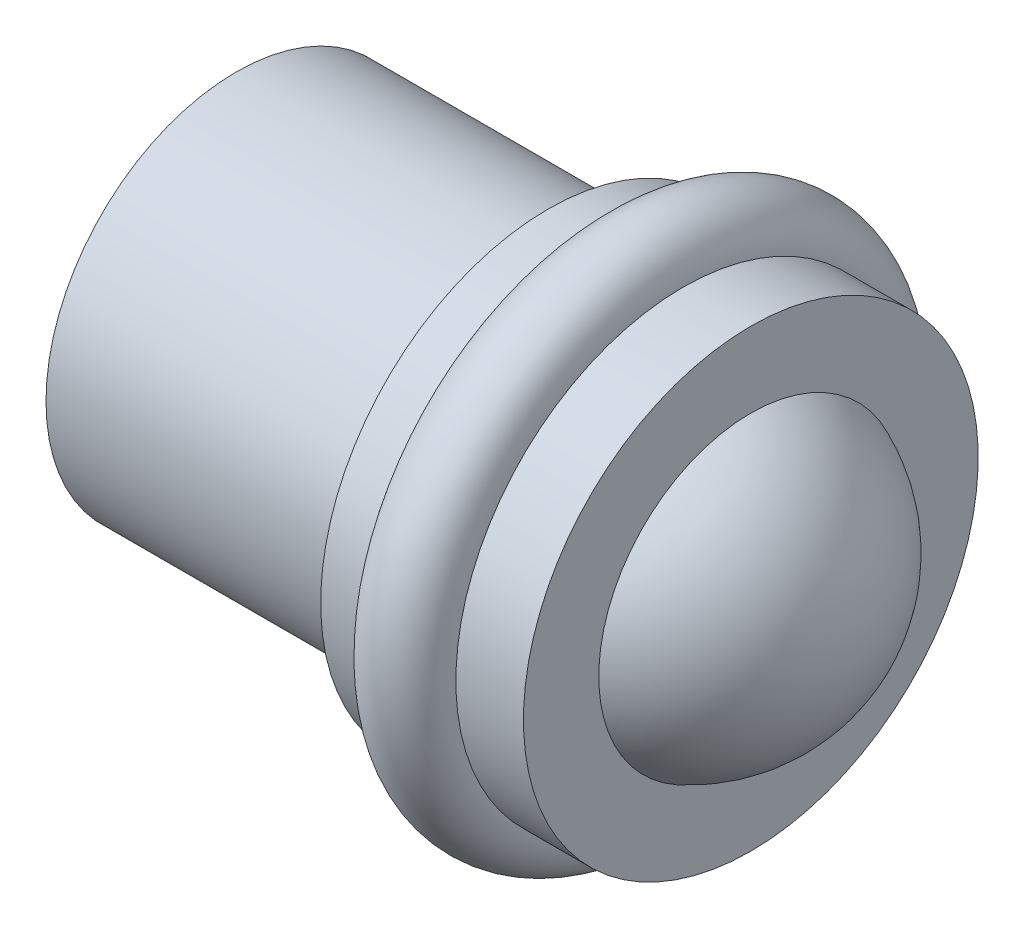
from build123d import *

# Parameters (mm, degrees)
SKETCH2_R = 1.11125


with BuildPart() as part:
    # Sketch1 → Revolve1 (revolve)
    with BuildSketch(Plane.XY, mode=Mode.PRIVATE) as revolve1_sk:
        with BuildLine():
            Line((-8.1153, 0), (-8.1153, 5.0038))
            Line((-8.1153, 5.0038), (0.0889, 5.0038))
            Line((0.0889, 5.0038), (0.0889, 5.9817))
            Line((0.0889, 5.9817), (1.4224, 5.9817))
            ThreePointArc((1.4224, 5.9817), (2.53365, 4.87045), (3.6449, 5.9817))
            Line((3.6449, 5.9817), (5.4229, 5.9817))
            Line((5.4229, 5.9817), (5.4229, 4.0005))
            ThreePointArc((5.4229, 4.0005), (7.379515264, 2.411069162), (8.1153, 0))
            Line((8.1153, 0), (-8.1153, 0))
        make_face()
    revolve(revolve1_sk.sketch.rotate(Axis((-8.1153, 0, 0), (1, 0, 0)), 180), axis=Axis((-8.1153, 0, 0), (1, 0, 0)))


with BuildPart() as body_2:
    # Sketch2 → Revolve2 (revolve)
    with BuildSketch(Plane.XY):
        with Locations((2.53365, 5.9817)):
            Circle(SKETCH2_R)
    revolve(axis=Axis((-8.1153, 0, 0), (1, 0, 0)))


solid = Compound([part.part, body_2.part])
